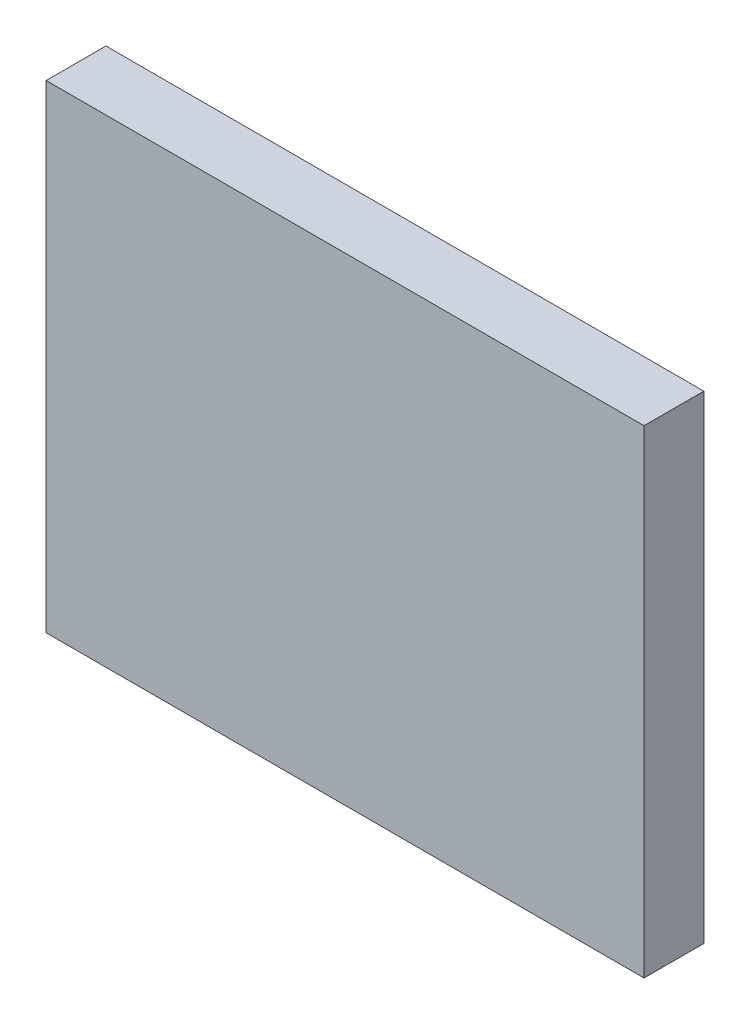
from build123d import *

# Parameters (mm, degrees)
SKETCH1_W           = 50
SKETCH1_H           = 40
BOSS_EXTRUDE1_DEPTH = 5


with BuildPart() as part:
    # Sketch1 → Boss-Extrude1 (new body)
    with BuildSketch(Plane.XY):
        with Locations((25, 20)):
            Rectangle(SKETCH1_W, SKETCH1_H)
    extrude(amount=BOSS_EXTRUDE1_DEPTH)


solid = part.part
